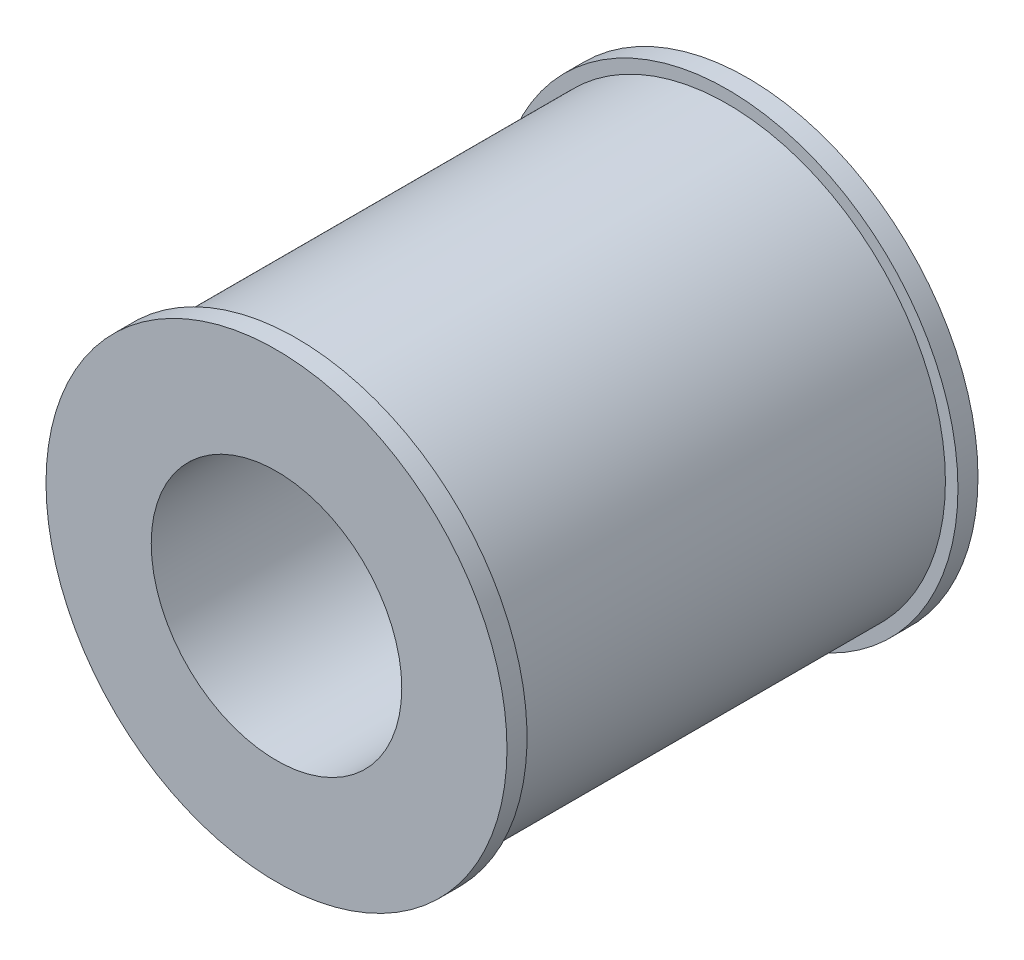
from build123d import *

# Parameters (mm, degrees)
SKETCH_1_R      = 23
SKETCH_1_R_2    = 12.5
EXTRUDE_1_DEPTH = 47
SKETCH_2_W      = 43
SKETCH_2_H      = 2.5


with BuildPart() as part:
    # Эскиз1 → Бобышка-Вытянуть1 (new body)
    with BuildSketch(Plane.XY):
        Circle(SKETCH_1_R)
        Circle(SKETCH_1_R_2, mode=Mode.SUBTRACT)
    extrude(amount=EXTRUDE_1_DEPTH)

    # Эскиз2 → Вырез-Повернуть1 (revolve, cut)
    with BuildSketch(Plane(origin=(0, 0, 0), x_dir=(0, 0, -1), z_dir=(1, 0, 0)), mode=Mode.PRIVATE) as cut_revolve_1_sk:
        with Locations((-23.5, 23)):
            Rectangle(SKETCH_2_W, SKETCH_2_H)
    revolve(cut_revolve_1_sk.sketch.rotate(Axis((0, 0, 47), (0, 0, -1)), 90), axis=Axis((0, 0, 47), (0, 0, -1)), mode=Mode.SUBTRACT)


solid = part.part
